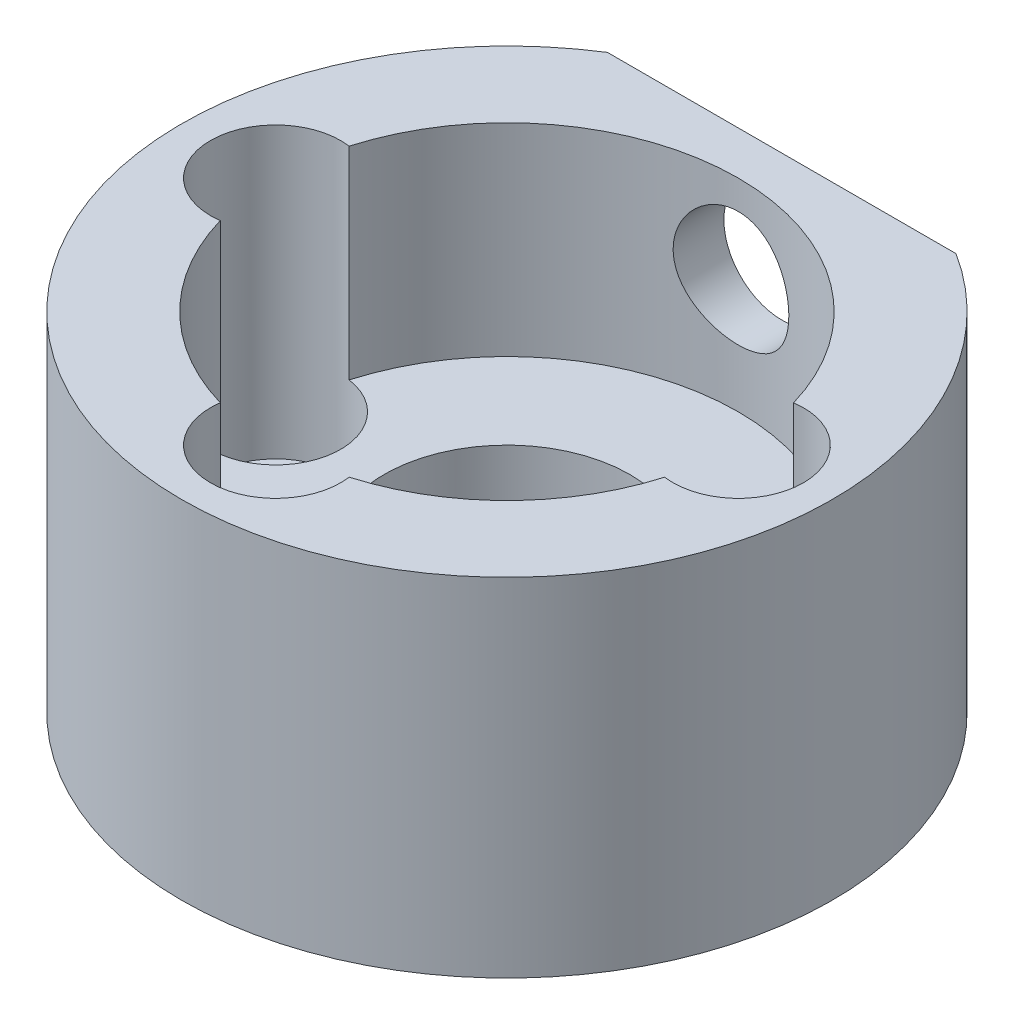
from build123d import *

# Parameters (mm, degrees)
BOSS_EXTRU_1_DEPTH                              = 12
CHAMBRAGE_POUR_VIS_T_TE_CYLINDRIQUE_D           = 2.5
CHAMBRAGE_POUR_VIS_T_TE_CYLINDRIQUE_CBORE_D     = 4.5
CHAMBRAGE_POUR_VIS_T_TE_CYLINDRIQUE_CBORE_DEPTH = 10
ESQUISSE12_R                                    = 8
ENL_V_MAT_EXTRU_1_DEPTH                         = 7
ESQUISSE14_R                                    = 2
ENL_V_MAT_EXTRU_2_DEPTH                         = 10
ESQUISSE15_R                                    = 4.25
ENL_V_MAT_EXTRU_3_DEPTH                         = 20.927995444


with BuildPart() as part:
    # Esquisse1 → Boss.-Extru.1 (new body)
    with BuildSketch(Plane(origin=(0, 0, 0), x_dir=(1, 0, 0), z_dir=(0, 1, 0))):
        with BuildLine():
            Line((6.025985397, 9.5), (-6.025985397, 9.5))
            ThreePointArc((-6.025985397, 9.5), (0, -11.25), (6.025985397, 9.5))
        make_face()
    extrude(amount=BOSS_EXTRU_1_DEPTH)

    # Chambrage pour vis à tête cylindrique à 6 pans creux (ou vis CHC) M21 (through all)
    with Locations(Plane(origin=(0, 12, 0), x_dir=(1, 0, 0), z_dir=(0, 1, 0))):
        with Locations((8, 0), (0, -8), (-8, 0)):
            CounterBoreHole(CHAMBRAGE_POUR_VIS_T_TE_CYLINDRIQUE_D / 2, CHAMBRAGE_POUR_VIS_T_TE_CYLINDRIQUE_CBORE_D / 2, CHAMBRAGE_POUR_VIS_T_TE_CYLINDRIQUE_CBORE_DEPTH)

    # Esquisse12 → Enlèv. mat.-Extru.1 (cut)
    with BuildSketch(Plane(origin=(0, 12, 0), x_dir=(1, 0, 0), z_dir=(0, 1, 0))):
        Circle(ESQUISSE12_R)
    extrude(amount=-ENL_V_MAT_EXTRU_1_DEPTH, mode=Mode.SUBTRACT)

    # Esquisse14 → Enlèv. mat.-Extru.2 (cut)
    with BuildSketch(Plane(origin=(0, 0, -9.5), x_dir=(-1, 0, 0), z_dir=(0, 0, -1))):
        with Locations((0, 9)):
            Circle(ESQUISSE14_R)
    extrude(amount=-ENL_V_MAT_EXTRU_2_DEPTH, mode=Mode.SUBTRACT)

    # Esquisse15 → Enlèv. mat.-Extru.3 (cut, through all)
    with BuildSketch(Plane.XZ):
        with Locations(Location((0, 0, 0), (0, 0, 270))):
            Circle(ESQUISSE15_R)
    extrude(amount=-ENL_V_MAT_EXTRU_3_DEPTH, mode=Mode.SUBTRACT)


solid = part.part
